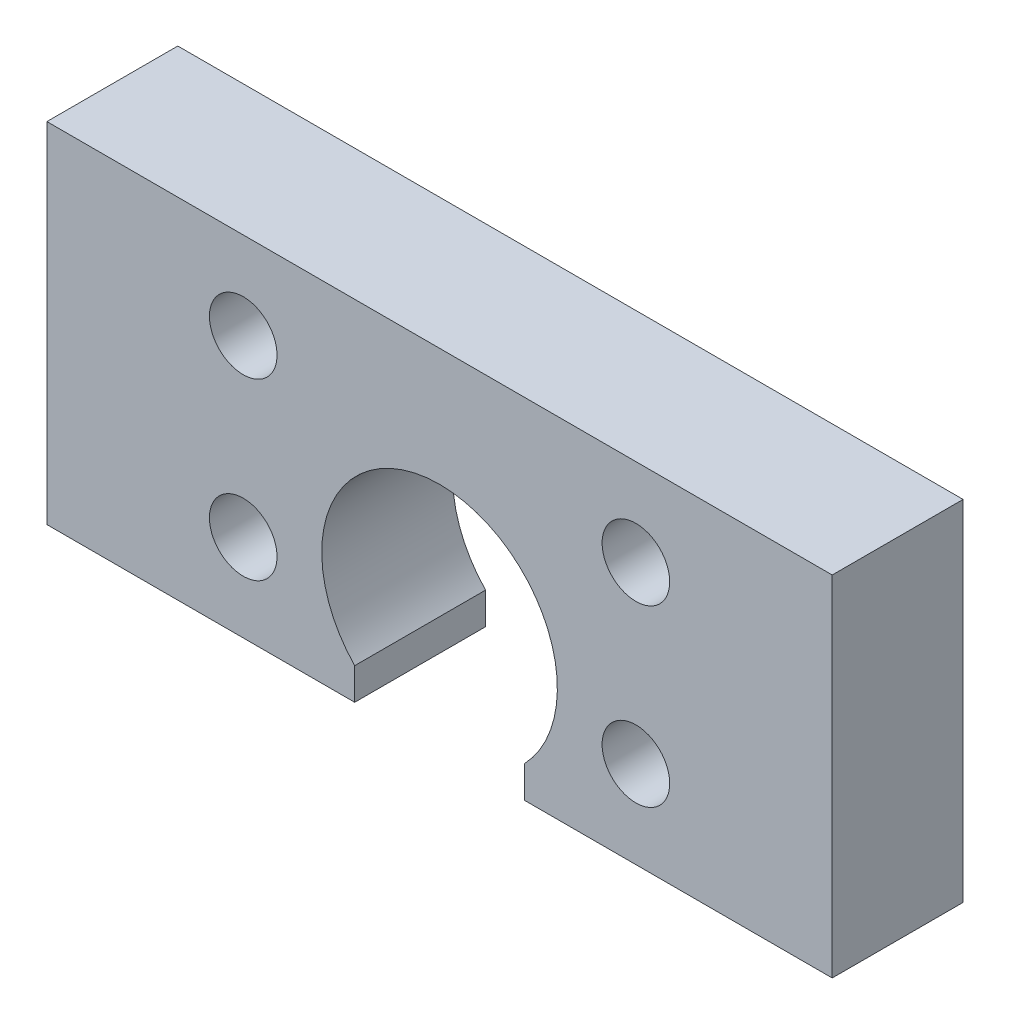
from build123d import *

# Parameters (mm, degrees)
SZKIC1_W                    = 36
SZKIC1_H                    = 16
DODANIE_WYCI_GNI_CIE1_DEPTH = 6
WYTNIJ_WYCI_GNI_CIE1_DEPTH  = 6
SZKIC3_R                    = 1.55
WYTNIJ_WYCI_GNI_CIE2_DEPTH  = 74.51650454


with BuildPart() as part:
    # Szkic1 → Dodanie-wyciągnięcie1 (new body)
    with BuildSketch(Plane.XY):
        with Locations((53.502982034, -8)):
            Rectangle(SZKIC1_W, SZKIC1_H)
    extrude(amount=-DODANIE_WYCI_GNI_CIE1_DEPTH)

    # Szkic2 → Wytnij-wyciągnięcie1 (cut)
    with BuildSketch(Plane.XY):
        with BuildLine():
            Line((49.612982034, -14.93), (49.612982034, -16))
            Line((49.612982034, -16), (57.392982034, -16))
            Line((57.392982034, -16), (57.392982034, -14.93))
            Line((57.392982034, -14.93), (57.392982034, -14.545383825))
            ThreePointArc((57.392982034, -14.545383825), (53.502982034, -5.4), (49.612982034, -14.545383825))
            Line((49.612982034, -14.545383825), (49.612982034, -14.93))
        make_face()
    extrude(amount=-WYTNIJ_WYCI_GNI_CIE1_DEPTH, mode=Mode.SUBTRACT)

    # Szkic3 → Wytnij-wyciągnięcie2 (cut, through all)
    with BuildSketch(Plane(origin=(0, 0, -6), x_dir=(-1, 0, 0), z_dir=(0, 0, -1))):
        with Locations((-44.502982034, -12)):
            Circle(SZKIC3_R)
        with Locations((-44.502982034, -4)):
            Circle(SZKIC3_R)
        with Locations((-62.502982034, -12)):
            Circle(SZKIC3_R)
        with Locations((-62.502982034, -4)):
            Circle(SZKIC3_R)
    extrude(amount=-WYTNIJ_WYCI_GNI_CIE2_DEPTH, mode=Mode.SUBTRACT)


solid = part.part
